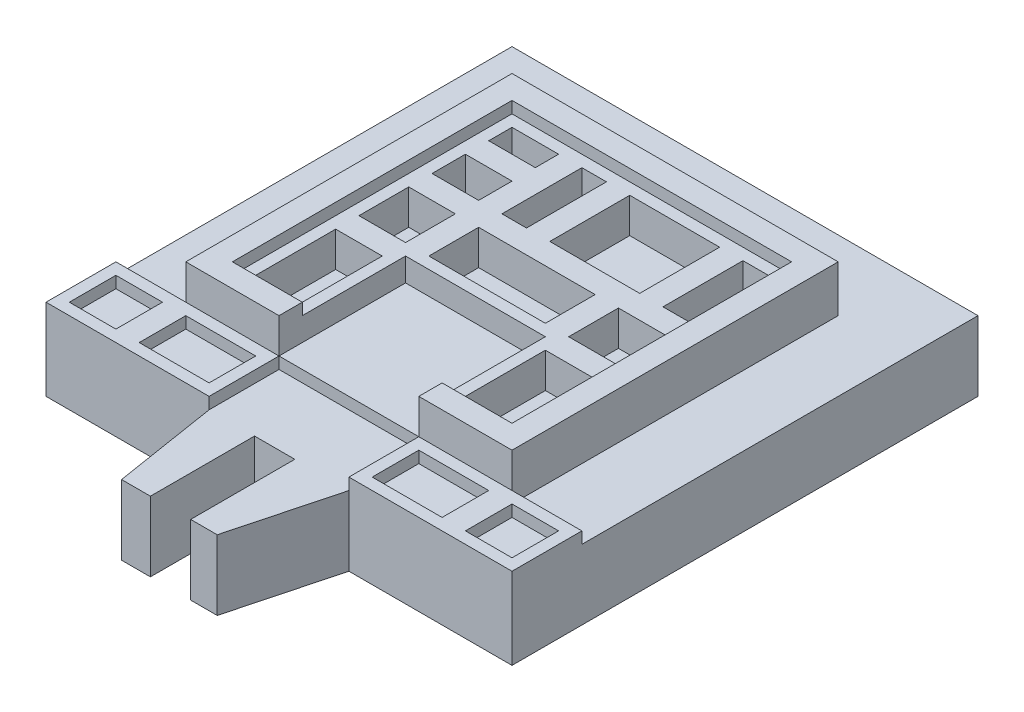
from build123d import *

# Parameters (mm, degrees)
CROQUIS1_W              = 20
CROQUIS1_H              = 20
SALIENTE_EXTRUIR1_DEPTH = 3
CROQUIS2_W              = 14
CROQUIS2_H              = 14
SALIENTE_EXTRUIR2_DEPTH = 2
CROQUIS3_W              = 12
CROQUIS3_H              = 12
CORTAR_EXTRUIR1_DEPTH   = 2
CROQUIS4_W              = 6
CROQUIS4_H              = 2.600399467
CORTAR_EXTRUIR2_DEPTH   = 3
SALIENTE_EXTRUIR3_DEPTH = 3
CROQUIS6_W              = 3
CROQUIS6_H              = 3
CROQUIS6_W_2            = 2
CROQUIS6_H_2            = 2
CROQUIS6_W_3            = 4
SALIENTE_EXTRUIR4_DEPTH = 0.5
CROQUIS7_W              = 6
CROQUIS7_H              = 2.831475003
CORTAR_EXTRUIR3_DEPTH   = 1
CROQUIS8_W              = 1
CROQUIS8_H              = 5.440516932
SALIENTE_EXTRUIR5_DEPTH = 0.5
CROQUIS10_W             = 3
CROQUIS10_H             = 4.43187447
CROQUIS10_W_2           = 2
CROQUIS10_H_2           = 3.43187447
CROQUIS10_H_3           = 3.13625106
CROQUIS10_H_4           = 2.13625106
CROQUIS10_H_5           = 2.43247793
CROQUIS10_H_6           = 1.43247793
CROQUIS10_W_3           = 1.053408661
CROQUIS10_W_4           = 3.858734252
CROQUIS10_W_5           = 5
CROQUIS10_W_6           = 2.087857087
CROQUIS10_W_7           = 1.087857087
CROQUIS10_H_7           = 1.99939654
CROQUIS10_H_8           = 0.99939654
SALIENTE_EXTRUIR6_DEPTH = 1.5
CROQUIS11_W             = 6
CROQUIS11_H             = 5.43187447
SALIENTE_EXTRUIR7_DEPTH = 1.5
CROQUIS12_R             = 1.575
CORTAR_EXTRUIR4_DEPTH   = 2.5


with BuildPart() as part:
    # Croquis1 → Saliente-Extruir1 (new body)
    with BuildSketch(Plane(origin=(0, 0, 0), x_dir=(1, 0, 0), z_dir=(0, 1, 0))):
        Rectangle(CROQUIS1_W, CROQUIS1_H)
    extrude(amount=SALIENTE_EXTRUIR1_DEPTH)

    # Croquis2 → Saliente-Extruir2 (add)
    with BuildSketch(Plane(origin=(0, 3, 0), x_dir=(1, 0, 0), z_dir=(0, 1, 0))):
        Rectangle(CROQUIS2_W, CROQUIS2_H)
    extrude(amount=SALIENTE_EXTRUIR2_DEPTH)

    # Croquis3 → Cortar-Extruir1 (cut)
    with BuildSketch(Plane(origin=(0, 5, 0), x_dir=(1, 0, 0), z_dir=(0, 1, 0))):
        Rectangle(CROQUIS3_W, CROQUIS3_H)
    extrude(amount=-CORTAR_EXTRUIR1_DEPTH, mode=Mode.SUBTRACT)

    # Croquis4 → Cortar-Extruir2 (cut)
    with BuildSketch(Plane(origin=(0, 5, 0), x_dir=(1, 0, 0), z_dir=(0, 1, 0))):
        with Locations((0, -5.699800267)):
            Rectangle(CROQUIS4_W, CROQUIS4_H)
    extrude(amount=-CORTAR_EXTRUIR2_DEPTH, mode=Mode.SUBTRACT)

    # Croquis5 → Saliente-Extruir3 (add)
    with BuildSketch(Plane(origin=(0, 0, 0), x_dir=(1, 0, 0), z_dir=(0, 1, 0))):
        Polygon((-3, -10), (-1.049339158, -10), (-1.049339158, -14.469917755), (-2.287906915, -14.469917755), align=None)
        Polygon((0.678136925, -10), (3, -10), (1.818923018, -14.469917755), (0.678136925, -14.469917755), align=None)
    extrude(amount=SALIENTE_EXTRUIR3_DEPTH)

    # Croquis6 → Saliente-Extruir4 (add)
    # profile 1 of 4: a face of its own
    with BuildSketch(Plane(origin=(0, 3, 0), x_dir=(1, 0, 0), z_dir=(0, 1, 0))):
        with Locations((-8.5, -8.5)):
            Rectangle(CROQUIS6_W, CROQUIS6_H)
        with Locations((-8.5, -8.5)):
            Rectangle(CROQUIS6_W_2, CROQUIS6_H_2, mode=Mode.SUBTRACT)
    # profile 2 of 4: a face of its own
    with BuildSketch(Plane(origin=(0, 3, 0), x_dir=(1, 0, 0), z_dir=(0, 1, 0))):
        with Locations((-5, -8.5)):
            Rectangle(CROQUIS6_W_3, CROQUIS6_H)
        with Locations((-5, -8.5)):
            Rectangle(CROQUIS6_W, CROQUIS6_H_2, mode=Mode.SUBTRACT)
    # profile 3 of 4: a face of its own
    with BuildSketch(Plane(origin=(0, 3, 0), x_dir=(1, 0, 0), z_dir=(0, 1, 0))):
        with Locations((5, -8.5)):
            Rectangle(CROQUIS6_W_3, CROQUIS6_H)
        with Locations((5, -8.5)):
            Rectangle(CROQUIS6_W, CROQUIS6_H_2, mode=Mode.SUBTRACT)
    # profile 4 of 4: a face of its own
    with BuildSketch(Plane(origin=(0, 3, 0), x_dir=(1, 0, 0), z_dir=(0, 1, 0))):
        with Locations((8.5, -8.5)):
            Rectangle(CROQUIS6_W, CROQUIS6_H)
        with Locations((8.5, -8.5)):
            Rectangle(CROQUIS6_W_2, CROQUIS6_H_2, mode=Mode.SUBTRACT)
    extrude(amount=SALIENTE_EXTRUIR4_DEPTH)

    # Croquis7 → Cortar-Extruir3 (cut)
    with BuildSketch(Plane(origin=(0, 3, 0), x_dir=(1, 0, 0), z_dir=(0, 1, 0))):
        with Locations((0, -2.983863032)):
            Rectangle(CROQUIS7_W, CROQUIS7_H)
    extrude(amount=-CORTAR_EXTRUIR3_DEPTH, mode=Mode.SUBTRACT)

    # Croquis8 → Saliente-Extruir5 (add)
    with BuildSketch(Plane(origin=(0, 3, 0), x_dir=(1, 0, 0), z_dir=(0, 1, 0))):
        with Locations((-2.5, -4.288383996)):
            Rectangle(CROQUIS8_W, CROQUIS8_H)
    extrude(amount=-SALIENTE_EXTRUIR5_DEPTH)

    # Croquis10 → Saliente-Extruir6 (add)
    # profile 1 of 10: a face of its own
    with BuildSketch(Plane(origin=(0, 3, 0), x_dir=(1, 0, 0), z_dir=(0, 1, 0))):
        with Locations((-4.5, -3.784062765)):
            Rectangle(CROQUIS10_W, CROQUIS10_H)
        with Locations((-4.5, -3.784062765)):
            Rectangle(CROQUIS10_W_2, CROQUIS10_H_2, mode=Mode.SUBTRACT)
    # profile 2 of 10: a face of its own
    with BuildSketch(Plane(origin=(0, 3, 0), x_dir=(1, 0, 0), z_dir=(0, 1, 0))):
        with Locations((-4.5, 0)):
            Rectangle(CROQUIS10_W, CROQUIS10_H_3)
        with Locations((-4.5, 0)):
            Rectangle(CROQUIS10_W_2, CROQUIS10_H_4, mode=Mode.SUBTRACT)
    # profile 3 of 10: a face of its own
    with BuildSketch(Plane(origin=(0, 3, 0), x_dir=(1, 0, 0), z_dir=(0, 1, 0))):
        with Locations((-4.5, 2.784364495)):
            Rectangle(CROQUIS10_W, CROQUIS10_H_5)
        with Locations((-4.5, 2.784364495)):
            Rectangle(CROQUIS10_W_2, CROQUIS10_H_6, mode=Mode.SUBTRACT)
    # profile 4 of 10: a face of its own
    with BuildSketch(Plane(origin=(0, 3, 0), x_dir=(1, 0, 0), z_dir=(0, 1, 0))):
        Polygon((-0.946591339, 6), (-3, 6), (-3, 4.00060346), (-3, 1.56812553), (-0.946591339, 1.56812553), align=None)
        with Locations((-1.97329567, 3.784062765)):
            Rectangle(CROQUIS10_W_3, CROQUIS10_H_2, mode=Mode.SUBTRACT)
    # profile 5 of 10: a face of its own
    with BuildSketch(Plane(origin=(0, 3, 0), x_dir=(1, 0, 0), z_dir=(0, 1, 0))):
        Polygon((3.912142913, 6), (-0.946591339, 6), (-0.946591339, 1.56812553), (3, 1.56812553), (3.912142913, 1.56812553), align=None)
        with Locations((1.482775787, 3.784062765)):
            Rectangle(CROQUIS10_W_4, CROQUIS10_H_2, mode=Mode.SUBTRACT)
    # profile 6 of 10: a face of its own
    with BuildSketch(Plane(origin=(0, 3, 0), x_dir=(1, 0, 0), z_dir=(0, 1, 0))):
        Polygon((-0.946591339, 1.56812553), (-3, 1.56812553), (-3, -1.56812553), (3, -1.56812553), (3, 1.56812553), align=None)
        Rectangle(CROQUIS10_W_5, CROQUIS10_H_4, mode=Mode.SUBTRACT)
    # profile 7 of 10: a face of its own
    with BuildSketch(Plane(origin=(0, 3, 0), x_dir=(1, 0, 0), z_dir=(0, 1, 0))):
        with Locations((4.956071457, 3.784062765)):
            Rectangle(CROQUIS10_W_6, CROQUIS10_H)
        with Locations((4.956071457, 3.784062765)):
            Rectangle(CROQUIS10_W_7, CROQUIS10_H_2, mode=Mode.SUBTRACT)
    # profile 8 of 10: a face of its own
    with BuildSketch(Plane(origin=(0, 3, 0), x_dir=(1, 0, 0), z_dir=(0, 1, 0))):
        Polygon((3.912142913, 1.56812553), (3, 1.56812553), (3, -1.56812553), (6, -1.56812553), (6, 1.56812553), align=None)
        with Locations((4.5, 0)):
            Rectangle(CROQUIS10_W_2, CROQUIS10_H_4, mode=Mode.SUBTRACT)
    # profile 9 of 10: a face of its own
    with BuildSketch(Plane(origin=(0, 3, 0), x_dir=(1, 0, 0), z_dir=(0, 1, 0))):
        with Locations((4.5, -3.784062765)):
            Rectangle(CROQUIS10_W, CROQUIS10_H)
        with Locations((4.5, -3.784062765)):
            Rectangle(CROQUIS10_W_2, CROQUIS10_H_2, mode=Mode.SUBTRACT)
    # profile 10 of 10: a face of its own
    with BuildSketch(Plane(origin=(0, 3, 0), x_dir=(1, 0, 0), z_dir=(0, 1, 0))):
        with Locations((-4.5, 5.00030173)):
            Rectangle(CROQUIS10_W, CROQUIS10_H_7)
        with Locations((-4.5, 5.00030173)):
            Rectangle(CROQUIS10_W_2, CROQUIS10_H_8, mode=Mode.SUBTRACT)
    extrude(amount=SALIENTE_EXTRUIR6_DEPTH)

    # Croquis11 → Saliente-Extruir7 (add)
    with BuildSketch(Plane(origin=(0, 2, 0), x_dir=(1, 0, 0), z_dir=(0, 1, 0))):
        with Locations((0, -4.284062765)):
            Rectangle(CROQUIS11_W, CROQUIS11_H)
    extrude(amount=SALIENTE_EXTRUIR7_DEPTH)

    # Croquis12 → Cortar-Extruir4 (cut)
    with BuildSketch(Plane.XZ):
        with Locations(Location((0, 0, 0), (0, 0, 270))):
            Circle(CROQUIS12_R)
    extrude(amount=-CORTAR_EXTRUIR4_DEPTH, mode=Mode.SUBTRACT)


solid = part.part
